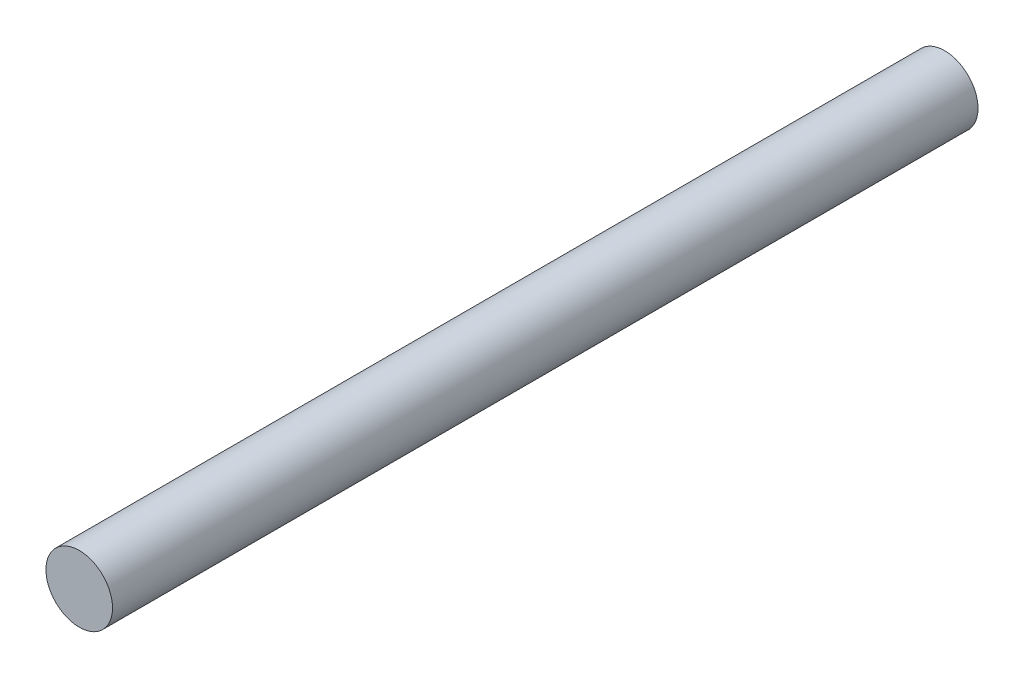
from build123d import *

# Parameters (mm, degrees)
CROQUIS1_R              = 10
SALIENTE_EXTRUIR1_DEPTH = 130


with BuildPart() as part:
    # Croquis1 → Saliente-Extruir1 (new, symmetric)
    with BuildSketch(Plane.XY):
        Circle(CROQUIS1_R)
    extrude(amount=SALIENTE_EXTRUIR1_DEPTH, both=True)


solid = part.part
